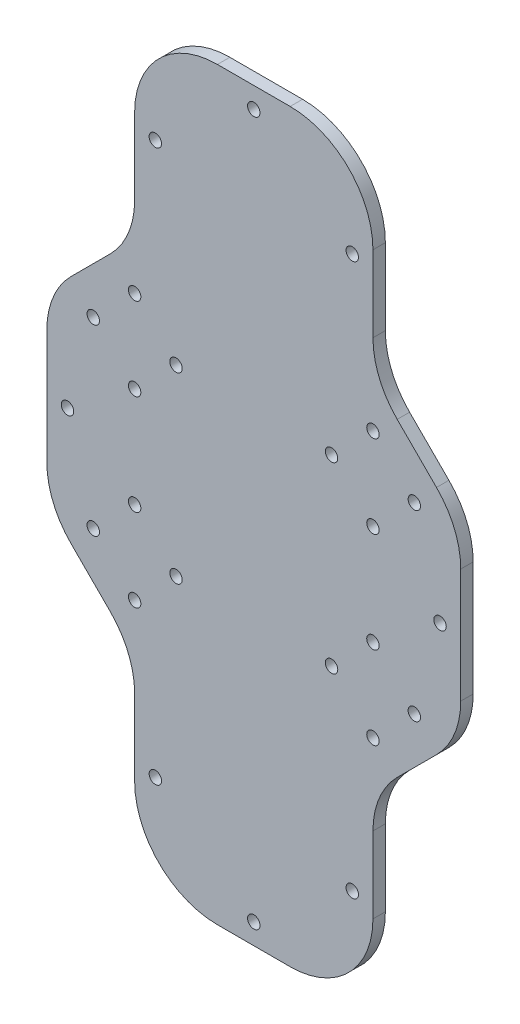
from build123d import *

# Parameters (mm, degrees)
SKETCH2_R           = 1.5
BOSS_EXTRUDE2_DEPTH = 3


with BuildPart() as part:
    # Sketch2 → Boss-Extrude2 (new body)
    with BuildSketch(Plane.XY):
        with BuildLine():
            Line((-50, -13.815728753), (-50, 13.815728753))
            ThreePointArc((-50, 13.815728753), (-48.47759065, 21.4693974), (-44.142135624, 27.957864376))
            Line((-44.142135624, 27.957864376), (-34.644660941, 37.455339059))
            ThreePointArc((-34.644660941, 37.455339059), (-30.309205914, 43.943806036), (-28.786796564, 51.597474683))
            Line((-28.786796564, 51.597474683), (-28.786796564, 70))
            ThreePointArc((-28.786796564, 70), (-22.928932188, 84.142135624), (-8.786796564, 90))
            Line((-8.786796564, 90), (8.786796564, 90))
            ThreePointArc((8.786796564, 90), (22.928932188, 84.142135624), (28.786796564, 70))
            Line((28.786796564, 70), (28.786796564, 51.597474683))
            ThreePointArc((28.786796564, 51.597474683), (30.309205914, 43.943806036), (34.644660941, 37.455339059))
            Line((34.644660941, 37.455339059), (44.142135624, 27.957864376))
            ThreePointArc((44.142135624, 27.957864376), (48.47759065, 21.4693974), (50, 13.815728753))
            Line((50, 13.815728753), (50, -13.815728753))
            ThreePointArc((50, -13.815728753), (48.47759065, -21.4693974), (44.142135624, -27.957864376))
            Line((44.142135624, -27.957864376), (34.644660941, -37.455339059))
            ThreePointArc((34.644660941, -37.455339059), (30.309205914, -43.943806036), (28.786796564, -51.597474683))
            Line((28.786796564, -51.597474683), (28.786796564, -70))
            ThreePointArc((28.786796564, -70), (22.928932188, -84.142135624), (8.786796564, -90))
            Line((8.786796564, -90), (-8.786796564, -90))
            ThreePointArc((-8.786796564, -90), (-22.928932188, -84.142135624), (-28.786796564, -70))
            Line((-28.786796564, -70), (-28.786796564, -51.597474683))
            ThreePointArc((-28.786796564, -51.597474683), (-30.309205914, -43.943806036), (-34.644660941, -37.455339059))
            Line((-34.644660941, -37.455339059), (-44.142135624, -27.957864376))
            ThreePointArc((-44.142135624, -27.957864376), (-48.47759065, -21.4693974), (-50, -13.815728753))
        make_face()
        with Locations((0, 85)):
            Circle(SKETCH2_R, mode=Mode.SUBTRACT)
        with Locations((-23.786796564, 66.656601718)):
            Circle(SKETCH2_R, mode=Mode.SUBTRACT)
        with Locations((-28.786796564, 32.1)):
            Circle(SKETCH2_R, mode=Mode.SUBTRACT)
        with Locations((-38.786796564, 22.1)):
            Circle(SKETCH2_R, mode=Mode.SUBTRACT)
        with Locations((-28.786796564, 12.1)):
            Circle(SKETCH2_R, mode=Mode.SUBTRACT)
        with Locations((-18.786796564, 22.1)):
            Circle(SKETCH2_R, mode=Mode.SUBTRACT)
        with Locations((-45, 0)):
            Circle(SKETCH2_R, mode=Mode.SUBTRACT)
        with Locations(Location((45, 0, 0), (0, 0, 180))):
            Circle(SKETCH2_R, mode=Mode.SUBTRACT)
        with Locations(Location((18.786796564, 22.1, 0), (0, 0, 180))):
            Circle(SKETCH2_R, mode=Mode.SUBTRACT)
        with Locations(Location((28.786796564, 12.1, 0), (0, 0, 180))):
            Circle(SKETCH2_R, mode=Mode.SUBTRACT)
        with Locations(Location((38.786796564, 22.1, 0), (0, 0, 180))):
            Circle(SKETCH2_R, mode=Mode.SUBTRACT)
        with Locations(Location((28.786796564, 32.1, 0), (0, 0, 180))):
            Circle(SKETCH2_R, mode=Mode.SUBTRACT)
        with Locations(Location((23.786796564, 66.656601718, 0), (0, 0, 180))):
            Circle(SKETCH2_R, mode=Mode.SUBTRACT)
        with Locations((28.786796564, -32.1)):
            Circle(SKETCH2_R, mode=Mode.SUBTRACT)
        with Locations((38.786796564, -22.1)):
            Circle(SKETCH2_R, mode=Mode.SUBTRACT)
        with Locations((28.786796564, -12.1)):
            Circle(SKETCH2_R, mode=Mode.SUBTRACT)
        with Locations((18.786796564, -22.1)):
            Circle(SKETCH2_R, mode=Mode.SUBTRACT)
        with Locations(Location((-18.786796564, -22.1, 0), (0, 0, 180))):
            Circle(SKETCH2_R, mode=Mode.SUBTRACT)
        with Locations(Location((-28.786796564, -12.1, 0), (0, 0, 180))):
            Circle(SKETCH2_R, mode=Mode.SUBTRACT)
        with Locations(Location((-38.786796564, -22.1, 0), (0, 0, 180))):
            Circle(SKETCH2_R, mode=Mode.SUBTRACT)
        with Locations(Location((-28.786796564, -32.1, 0), (0, 0, 180))):
            Circle(SKETCH2_R, mode=Mode.SUBTRACT)
        with Locations((23.786796564, -66.656601718)):
            Circle(SKETCH2_R, mode=Mode.SUBTRACT)
        with Locations(Location((-23.786796564, -66.656601718, 0), (0, 0, 180))):
            Circle(SKETCH2_R, mode=Mode.SUBTRACT)
        with Locations(Location((0, -85, 0), (0, 0, 180))):
            Circle(SKETCH2_R, mode=Mode.SUBTRACT)
    extrude(amount=BOSS_EXTRUDE2_DEPTH)


solid = part.part
